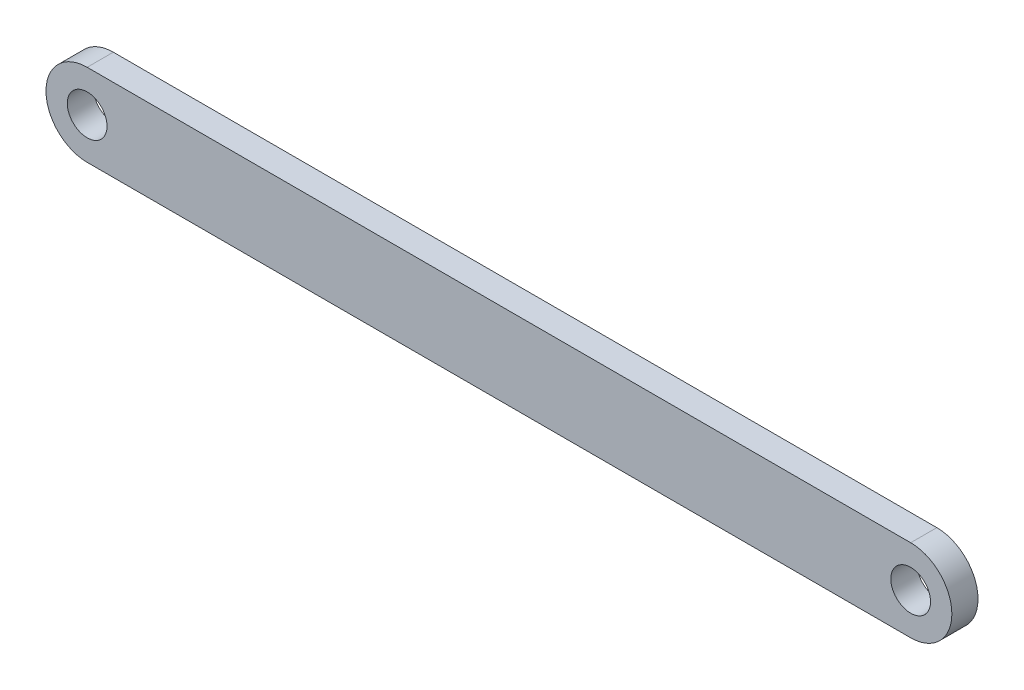
from build123d import *

# Parameters (mm, degrees)
SKETCH1_R           = 2.413
BOSS_EXTRUDE1_DEPTH = 3.175


with BuildPart() as part:
    # Sketch1 → Boss-Extrude1 (new body)
    with BuildSketch(Plane.XY):
        with BuildLine():
            Line((-50, 5), (50, 5))
            ThreePointArc((50, 5), (55, 0), (50, -5))
            Line((50, -5), (-50, -5))
            ThreePointArc((-50, -5), (-55, 0), (-50, 5))
        make_face()
        with Locations((-50, 0)):
            Circle(SKETCH1_R, mode=Mode.SUBTRACT)
        with Locations((50, 0)):
            Circle(SKETCH1_R, mode=Mode.SUBTRACT)
    extrude(amount=BOSS_EXTRUDE1_DEPTH)


solid = part.part
